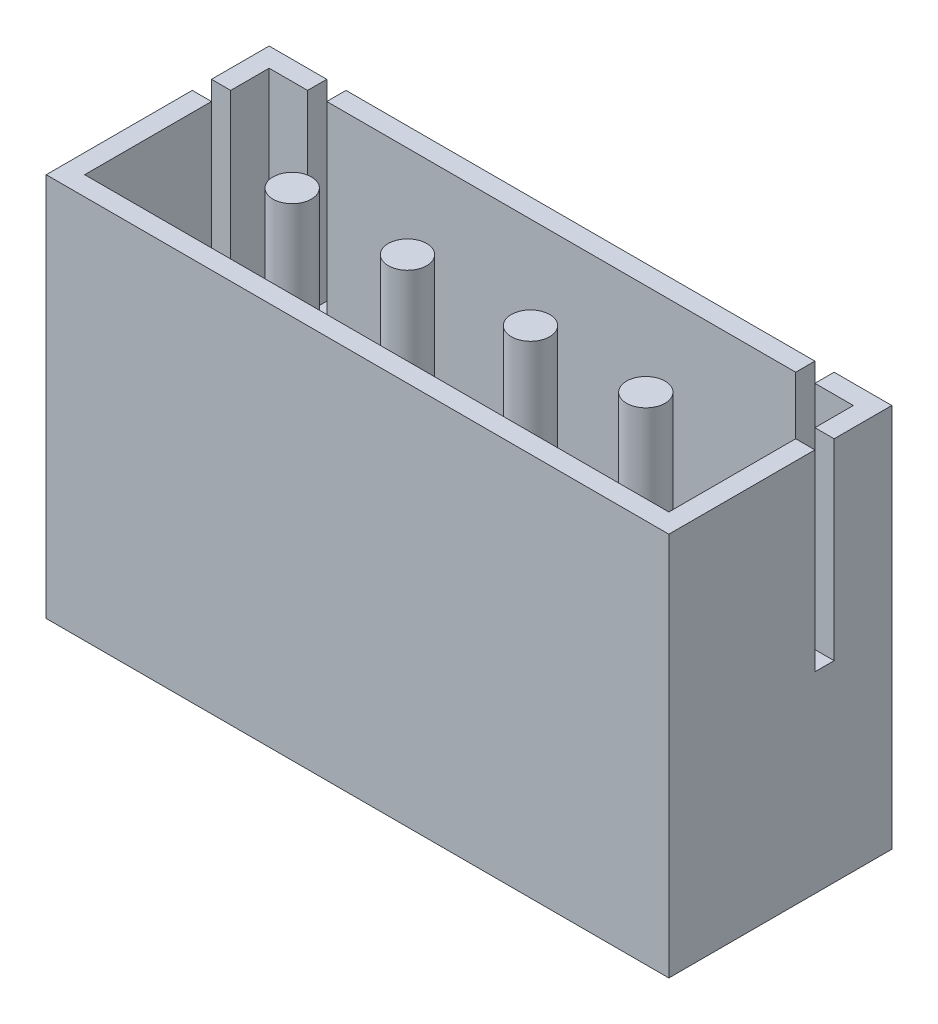
from build123d import *

# Parameters (mm, degrees)
SKETCH_1_W          = 16.2
SKETCH_1_H          = 5.8
EXTRUDE_1_DEPTH     = 10
SKETCH_2_W          = 15.2
SKETCH_2_H          = 4.8
CUT_EXTRUDE_1_DEPTH = 6
SKETCH_3_R          = 0.5
EXTRUDE_2_DEPTH     = 6
SKETCH_4_W          = 0.5
SKETCH_4_H          = 0.5
CUT_EXTRUDE_2_DEPTH = 5


with BuildPart() as part:
    # Эскиз1 → Бобышка-Вытянуть1 (new body)
    with BuildSketch(Plane(origin=(0, 0, 0), x_dir=(1, 0, 0), z_dir=(0, 1, 0))):
        Rectangle(SKETCH_1_W, SKETCH_1_H)
    extrude(amount=EXTRUDE_1_DEPTH)

    # Эскиз2 → Вырез-Вытянуть1 (cut)
    with BuildSketch(Plane(origin=(0, 10, 0), x_dir=(1, 0, 0), z_dir=(0, 1, 0))):
        Rectangle(SKETCH_2_W, SKETCH_2_H)
    extrude(amount=-CUT_EXTRUDE_1_DEPTH, mode=Mode.SUBTRACT)

    # Эскиз3 → Бобышка-Вытянуть2 (add)
    with BuildSketch(Plane(origin=(0, 4, 0), x_dir=(1, 0, 0), z_dir=(0, 1, 0))):
        with Locations(Location((-4.6, 0, 0), (0, 0, 270))):
            Circle(SKETCH_3_R)
        with Locations(Location((-1.6, 0, 0), (0, 0, 270))):
            Circle(SKETCH_3_R)
        with Locations(Location((1.6, 0, 0), (0, 0, 270))):
            Circle(SKETCH_3_R)
        with Locations(Location((4.6, 0, 0), (0, 0, 270))):
            Circle(SKETCH_3_R)
    extrude(amount=EXTRUDE_2_DEPTH)

    # Эскиз4 → Вырез-Вытянуть2 (cut)
    with BuildSketch(Plane(origin=(0, 10, 0), x_dir=(1, 0, 0), z_dir=(0, 1, 0))):
        with Locations((-6.35, 2.65)):
            Rectangle(SKETCH_4_W, SKETCH_4_H)
        with Locations((-7.85, 1.15)):
            Rectangle(SKETCH_4_W, SKETCH_4_H)
    cut_extrude_2 = extrude(amount=-CUT_EXTRUDE_2_DEPTH, mode=Mode.SUBTRACT)

    # Зеркальное отражение1: Вырез-Вытянуть2 across plane
    add(cut_extrude_2.mirror(Plane(origin=(0, 0, 0), x_dir=(0, 0, 1), z_dir=(1, 0, 0))), mode=Mode.SUBTRACT)


solid = part.part
